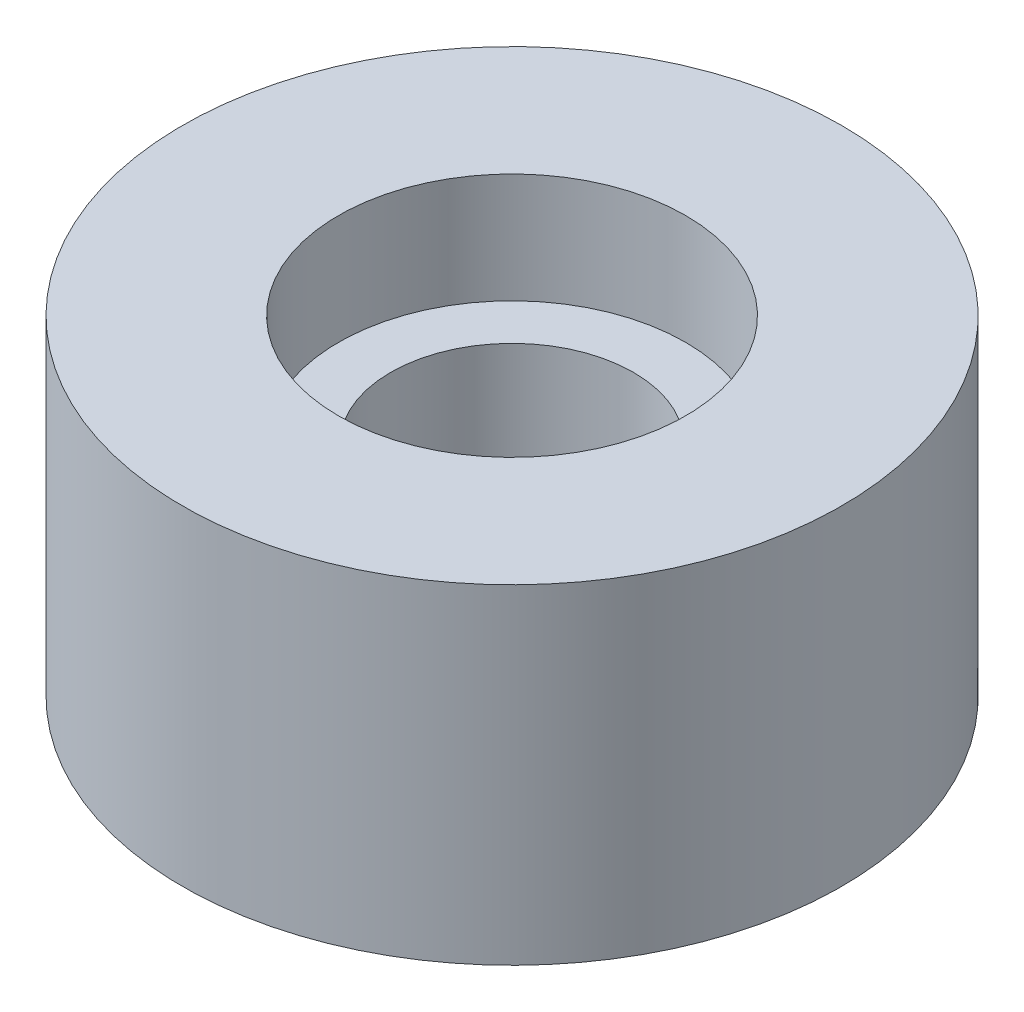
from build123d import *

# Parameters (mm, degrees)
SKETCH1_R           = 38.1
BOSS_EXTRUDE1_DEPTH = 38.1
SKETCH2_R           = 14.0462
CUT_EXTRUDE1_DEPTH  = 76.2
SKETCH3_R           = 20.066
CUT_EXTRUDE2_DEPTH  = 12.7
SKETCH4_R           = 30.0355
CUT_EXTRUDE3_DEPTH  = 12.7


with BuildPart() as part:
    # Sketch1 → Boss-Extrude1 (new body)
    with BuildSketch(Plane(origin=(0, 0, 0), x_dir=(1, 0, 0), z_dir=(0, 1, 0))):
        with Locations(Location((0, 0, 0), (0, 0, 90))):
            Circle(SKETCH1_R)
    extrude(amount=BOSS_EXTRUDE1_DEPTH)

    # Sketch2 → Cut-Extrude1 (cut)
    with BuildSketch(Plane.XZ):
        with Locations(Location((0, 0, 0), (0, 0, 270))):
            Circle(SKETCH2_R)
    extrude(amount=-CUT_EXTRUDE1_DEPTH, mode=Mode.SUBTRACT)

    # Sketch3 → Cut-Extrude2 (cut)
    with BuildSketch(Plane(origin=(0, 38.1, 0), x_dir=(1, 0, 0), z_dir=(0, 1, 0))):
        with Locations(Location((0, 0, 0), (0, 0, 270))):
            Circle(SKETCH3_R)
    extrude(amount=-CUT_EXTRUDE2_DEPTH, mode=Mode.SUBTRACT)

    # Sketch4 → Cut-Extrude3 (cut)
    with BuildSketch(Plane.XZ):
        with Locations(Location((0, 0, 0), (0, 0, 270))):
            Circle(SKETCH4_R)
    extrude(amount=-CUT_EXTRUDE3_DEPTH, mode=Mode.SUBTRACT)


solid = part.part
